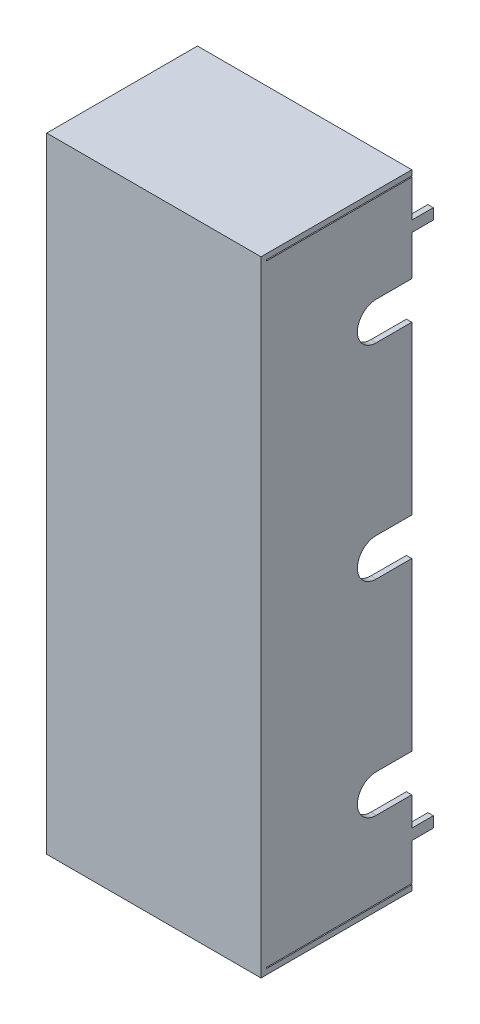
from build123d import *

# Parameters (mm, degrees)
ESQUISSE1_W             = 0.5
ESQUISSE1_H             = 56.8
EXTRUSION1_DEPTH        = 13.5
EXTRUSION1_2_DEPTH      = 13.5
ESQUISSE1_W_2           = 19.9
ESQUISSE1_H_2           = 0.5
EXTRUSION1_3_DEPTH      = 13.5
EXTRUSION1_4_DEPTH      = 13.5
ESQUISSE2_W             = 19.9
ESQUISSE2_H             = 58
EXTRUSION2_DEPTH        = 0.5
ENL_V_MAT_EXTRU_1_DEPTH = 10.5
ESQUISSE4_W             = 0.5
ESQUISSE4_H             = 1
EXTRUSION3_DEPTH        = 2


with BuildPart() as part:
    # Esquisse1 → Extrusion1 (new body)
    with BuildSketch(Plane.XY):
        with Locations((91.99228109, 2.086823856)):
            Rectangle(ESQUISSE1_W, ESQUISSE1_H)
    extrude(amount=EXTRUSION1_DEPTH)



with BuildPart() as body_2:
    # Esquisse1 → Extrusion1 2 (new body)
    with BuildSketch(Plane.XY):
        with Locations((111.39228109, 2.086823856)):
            Rectangle(ESQUISSE1_W, ESQUISSE1_H)
    extrude(amount=EXTRUSION1_2_DEPTH)


with BuildPart() as body_3:
    # Esquisse1 → Extrusion1 3 (new body)
    with BuildSketch(Plane.XY):
        with Locations((101.69228109, 30.836823856)):
            Rectangle(ESQUISSE1_W_2, ESQUISSE1_H_2)
    extrude(amount=EXTRUSION1_3_DEPTH)


with BuildPart() as body_4:
    # Esquisse1 → Extrusion1 4 (new body)
    with BuildSketch(Plane.XY):
        with Locations((101.69228109, -26.663176144)):
            Rectangle(ESQUISSE1_W_2, ESQUISSE1_H_2)
    extrude(amount=EXTRUSION1_4_DEPTH)


with BuildPart() as part_1:
    add(part.part)

    add(body_2.part)  # Extrusion2 merges body 2

    add(body_3.part)  # Extrusion2 merges body 3

    add(body_4.part)  # Extrusion2 merges body 4
    # Esquisse2 → Extrusion2 (add)
    with BuildSketch(Plane.XY.offset(13.5)):
        with Locations((101.69228109, 2.086823856)):
            Rectangle(ESQUISSE2_W, ESQUISSE2_H)
    extrude(amount=EXTRUSION2_DEPTH)

    # Esquisse3 → Enlèv. mat.-Extru.1 (cut)
    with BuildSketch(Plane(origin=(111.64228109, 0, 0), x_dir=(0, 0, -1), z_dir=(1, 0, 0))):
        with BuildLine():
            Line((0, 22.321054975), (0, 18.821054975))
            Line((0, 18.821054975), (-3.3, 18.821054975))
            ThreePointArc((-3.3, 18.821054975), (-5.05, 20.571054975), (-3.3, 22.321054975))
            Line((-3.3, 22.321054975), (0, 22.321054975))
        make_face()
        with BuildLine():
            Line((0, 3.321054975), (0, -0.178945025))
            Line((0, -0.178945025), (-3.3, -0.178945025))
            ThreePointArc((-3.3, -0.178945025), (-5.05, 1.571054975), (-3.3, 3.321054975))
            Line((-3.3, 3.321054975), (0, 3.321054975))
        make_face()
        with BuildLine():
            Line((0, -15.678945025), (0, -19.178945025))
            Line((0, -19.178945025), (-3.3, -19.178945025))
            ThreePointArc((-3.3, -19.178945025), (-5.05, -17.428945025), (-3.3, -15.678945025))
            Line((-3.3, -15.678945025), (0, -15.678945025))
        make_face()
    extrude(amount=-ENL_V_MAT_EXTRU_1_DEPTH, mode=Mode.SUBTRACT)

    # Esquisse4 → Extrusion3 (add)
    with BuildSketch(Plane(origin=(0, 0, 0), x_dir=(-1, 0, 0), z_dir=(0, 0, -1))):
        with Locations((-111.39228109, 26.536823856)):
            Rectangle(ESQUISSE4_W, ESQUISSE4_H)
        with Locations((-91.99228109, 26.536823856)):
            Rectangle(ESQUISSE4_W, ESQUISSE4_H)
        with Locations((-111.39228109, -22.363176144)):
            Rectangle(ESQUISSE4_W, ESQUISSE4_H)
        with Locations((-91.99228109, -22.363176144)):
            Rectangle(ESQUISSE4_W, ESQUISSE4_H)
    extrude(amount=EXTRUSION3_DEPTH)


solid = part_1.part
